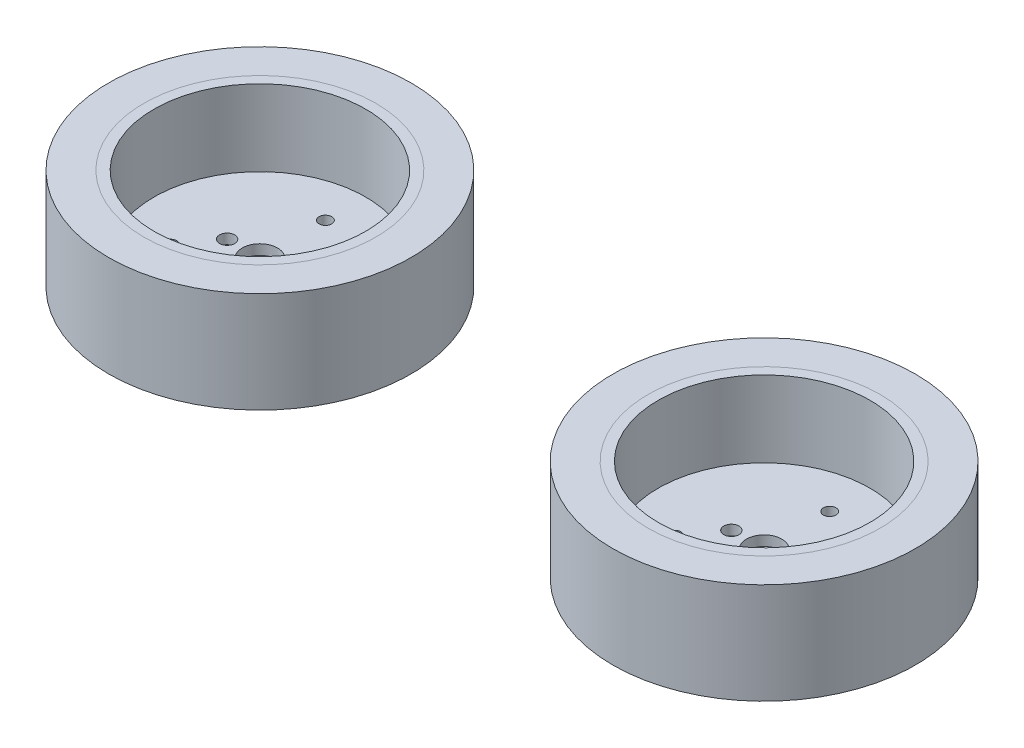
from build123d import *

# Parameters (mm, degrees)
SKETCH_1_W                  = 7
SKETCH_1_H                  = 20
SKETCH_2_R                  = 1.5
CUT_EXTRUDE_1_DEPTH         = 88.134436361
SKETCH_4_W                  = 1.25
SKETCH_4_H                  = 20
HOLE_WIZARD_M3_1_AT_2_COUNT = 2
HOLE_WIZARD_M3_1_AT_2_PITCH = 22.516660498
HOLE_WIZARD_M3_1_AT_3_COUNT = 2
HOLE_WIZARD_M3_1_AT_3_PITCH = 22.516660498


with BuildPart() as part:
    # 草图1 → 旋转1 (revolve)
    with BuildSketch(Plane.XY):
        with Locations((-23.5, 0)):
            Rectangle(SKETCH_1_W, SKETCH_1_H)
    revolve(axis=Axis((-50, 37, 0), (0, -1, 0)))


with BuildPart() as body_2:
    # 草图1<5> → 旋转2 (revolve)
    with BuildSketch(Plane.XY):
        Polygon((-27, -10), (-27, 10), (-29, 10), (-29, -5.1), (-46.5, -5.1), (-46.5, -7.1), (-39.5, -7.1), (-39.5, -10), (-34.5, -10), (-34.5, -7.1), (-29, -7.1), (-29, -10), align=None)
    revolve(axis=Axis((-50, 37, 0), (0, -1, 0)))

    # 草图2 → 切除-拉伸1 (cut, through all)
    with BuildSketch(Plane(origin=(0, -7.1, 0), x_dir=(-1, 0, 0), z_dir=(0, -1, 0))):
        with Locations((43.5, 0)):
            Circle(SKETCH_2_R)
        with Locations((56.5, 0)):
            Circle(SKETCH_2_R)
    extrude(amount=-CUT_EXTRUDE_1_DEPTH, mode=Mode.SUBTRACT)

    # 草图4 → M3 螺纹孔1 (revolve, cut)
    with BuildSketch(Plane(origin=(-50, -10, -13), x_dir=(0, 0, -1), z_dir=(1, 0, 0))):
        with Locations((0.625, 10)):
            Rectangle(SKETCH_4_W, SKETCH_4_H)
    hole_wizard_m3_1 = revolve(axis=Axis((-50, -16.35, -13), (0, 1, 0)), mode=Mode.SUBTRACT)

    # M3 螺纹孔1 at 2: M3 螺纹孔1 ×2
    with Locations(*[Vector(-0.5000000000000003, 0, 0.8660254037844385) * (i * HOLE_WIZARD_M3_1_AT_2_PITCH) for i in range(1, HOLE_WIZARD_M3_1_AT_2_COUNT)]):
        add(hole_wizard_m3_1, mode=Mode.SUBTRACT)

    # M3 螺纹孔1 at 3: M3 螺纹孔1 ×2
    with Locations(*[Vector(0.5000000000000001, 0, 0.8660254037844386) * (i * HOLE_WIZARD_M3_1_AT_3_PITCH) for i in range(1, HOLE_WIZARD_M3_1_AT_3_COUNT)]):
        add(hole_wizard_m3_1, mode=Mode.SUBTRACT)


with BuildPart() as body_3:
    # 镜向2: mirrored copy
    add(part.part.mirror(Plane(origin=(0, 0, 0), x_dir=(0, 0, 1), z_dir=(1, 0, 0))))


with BuildPart() as body_4:
    # Mirror 2 2: mirrored copy
    add(body_2.part.mirror(Plane(origin=(0, 0, 0), x_dir=(0, 0, 1), z_dir=(1, 0, 0))))


solid = Compound([part.part, body_2.part, body_3.part, body_4.part])
